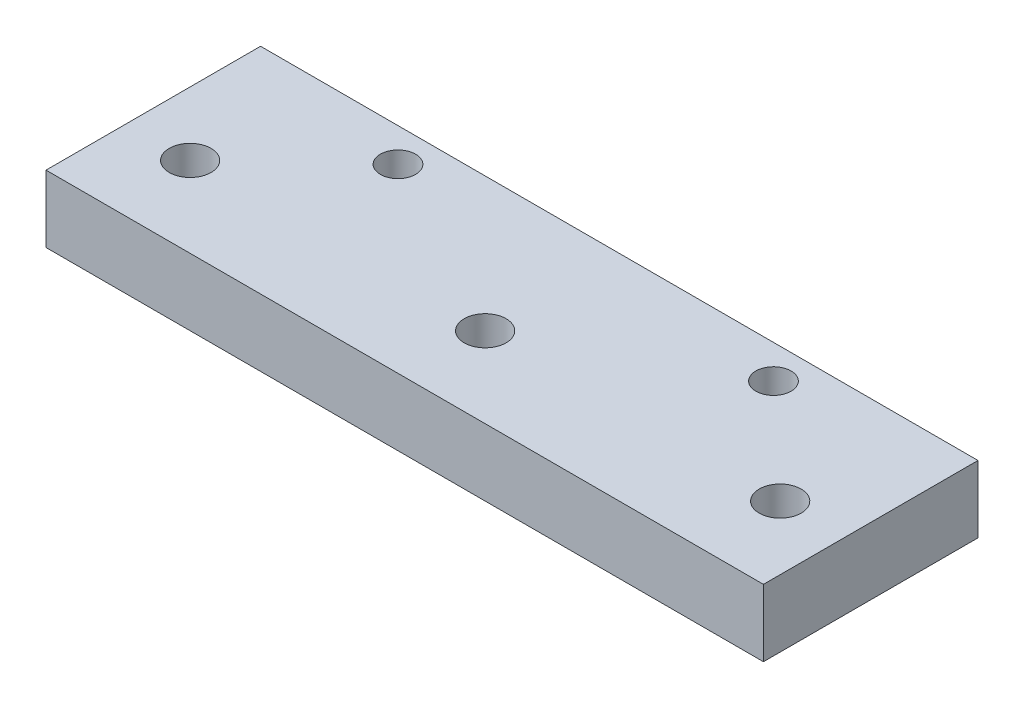
from build123d import *

# Parameters (mm, degrees)
SKETCH1_W           = 339.725
SKETCH1_H           = 101.6
BOSS_EXTRUDE1_DEPTH = 15.875
CUT_EXTRUDE2_START  = -15.875
SKETCH2_R           = 9.9187
CUT_EXTRUDE2_DEPTH  = 63.5
CUT_EXTRUDE4_START  = -15.875
SKETCH3_R           = 15.0876
CUT_EXTRUDE4_DEPTH  = 3.175
CUT_EXTRUDE6_START  = -15.875
SKETCH4_R           = 8.3312
CUT_EXTRUDE6_DEPTH  = 63.5


with BuildPart() as part:
    # Sketch1 → Boss-Extrude1 (new, symmetric)
    with BuildSketch(Plane(origin=(0, 0, 0), x_dir=(1, 0, 0), z_dir=(0, 1, 0))):
        Rectangle(SKETCH1_W, SKETCH1_H)
    extrude(amount=BOSS_EXTRUDE1_DEPTH, both=True)

    # Sketch2 → Cut-Extrude2 (cut)
    with BuildSketch(Plane(origin=(0, 0, 0), x_dir=(1, 0, 0), z_dir=(0, 1, 0)).offset(CUT_EXTRUDE2_START)):
        with Locations(Location((-139.7127, -12.7, 0), (0, 0, 90))):
            Circle(SKETCH2_R)
        with Locations(Location((-0.0127, -12.7, 0), (0, 0, 90))):
            Circle(SKETCH2_R)
        with Locations(Location((139.6873, -12.7, 0), (0, 0, 90))):
            Circle(SKETCH2_R)
    extrude(amount=CUT_EXTRUDE2_DEPTH, mode=Mode.SUBTRACT)

    # Sketch3 → Cut-Extrude4 (cut)
    with BuildSketch(Plane(origin=(0, 0, 0), x_dir=(1, 0, 0), z_dir=(0, 1, 0)).offset(CUT_EXTRUDE4_START)):
        with Locations(Location((-139.7127, -12.7, 0), (0, 0, 270))):
            Circle(SKETCH3_R)
        with Locations(Location((-0.0127, -12.7, 0), (0, 0, 270))):
            Circle(SKETCH3_R)
        with Locations(Location((139.6873, -12.7, 0), (0, 0, 270))):
            Circle(SKETCH3_R)
    extrude(amount=CUT_EXTRUDE4_DEPTH, mode=Mode.SUBTRACT)

    # Sketch4 → Cut-Extrude6 (cut)
    with BuildSketch(Plane(origin=(0, 0, 0), x_dir=(1, 0, 0), z_dir=(0, 1, 0)).offset(CUT_EXTRUDE6_START)):
        with Locations(Location((-88.9127, 34.925, 0), (0, 0, 90))):
            Circle(SKETCH4_R)
        with Locations(Location((88.8873, 34.925, 0), (0, 0, 90))):
            Circle(SKETCH4_R)
    extrude(amount=CUT_EXTRUDE6_DEPTH, mode=Mode.SUBTRACT)


solid = part.part
